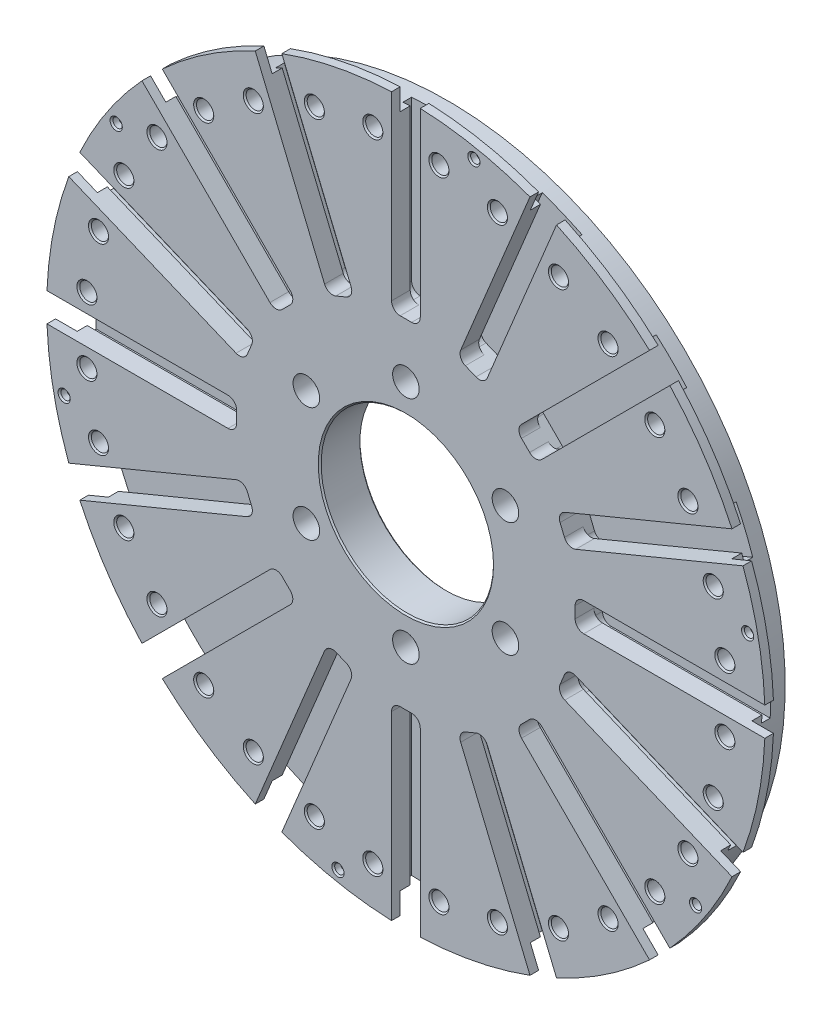
from build123d import *

# Parameters (mm, degrees)
SCHIZZO1_R                      = 250
ESTRUSIONE_ESTRUSIONE1_DEPTH    = 29
TAGLIO_ESTRUSIONE1_START        = -23
SCHIZZO2_R                      = 250
SCHIZZO2_R_2                    = 235
TAGLIO_ESTRUSIONE1_DEPTH        = 23
FORO1_D                         = 12.5
FORO1_DEPTH                     = 29.849623113
FORO1_CBORE_D                   = 18.5
FORO1_CBORE_DEPTH               = 13
RIPETIZIONECIRCOLARE1_COUNT     = 6
FORO_12_0_12_1_D                = 12
SCHIZZO9_R                      = 60
TAGLIO_ESTRUSIONE2_DEPTH        = 29
SCHIZZO10_R                     = 3.25
TAGLIO_ESTRUSIONE3_DEPTH        = 6
RIPETIZIONECIRCOLARE3_COUNT     = 3
RIPETIZIONECIRCOLARE3_ANGLE     = 135
SCHIZZO11_R                     = 3.25
TAGLIO_ESTRUSIONE4_DEPTH        = 6
RIPETIZIONECIRCOLARE4_COUNT     = 3
RIPETIZIONECIRCOLARE4_ANGLE     = 135
TAGLIO_ESTRUSIONE5_DEPTH        = 13
TAGLIO_ESTRUSIONE6_DEPTH        = 6
SMUSSO1_SIZE                    = 1
RIPETIZIONECIRCOLARE7_COUNT     = 16
RIPETIZIONECIRCOLARE7_COPY_1_D  = 12
RIPETIZIONECIRCOLARE7_COPY_2_D  = 12
RIPETIZIONECIRCOLARE7_COPY_3_D  = 12
RIPETIZIONECIRCOLARE7_COPY_4_D  = 12
RIPETIZIONECIRCOLARE7_COPY_5_D  = 12
RIPETIZIONECIRCOLARE7_COPY_6_D  = 12
RIPETIZIONECIRCOLARE7_COPY_7_D  = 12
RIPETIZIONECIRCOLARE7_COPY_8_D  = 12
RIPETIZIONECIRCOLARE7_COPY_9_D  = 12
RIPETIZIONECIRCOLARE7_COPY_10_D = 12
RIPETIZIONECIRCOLARE7_COPY_11_D = 12
RIPETIZIONECIRCOLARE7_COPY_12_D = 12
RIPETIZIONECIRCOLARE7_COPY_13_D = 12
RIPETIZIONECIRCOLARE7_COPY_14_D = 12
RIPETIZIONECIRCOLARE7_COPY_15_D = 12
SMUSSO3_SIZE                    = 1
SMUSSO4_SIZE                    = 1


with BuildPart() as part:
    # Schizzo1 → Estrusione-Estrusione1 (new body)
    with BuildSketch(Plane.XY):
        Circle(SCHIZZO1_R)
    extrude(amount=-ESTRUSIONE_ESTRUSIONE1_DEPTH)

    # Schizzo2 → Taglio-Estrusione1 (cut)
    with BuildSketch(Plane(origin=(0, 0, -29), x_dir=(-1, 0, 0), z_dir=(0, 0, -1)).offset(TAGLIO_ESTRUSIONE1_START)):
        with Locations(Location((0, 0, 0), (0, 0, 180))):
            Circle(SCHIZZO2_R)
        Circle(SCHIZZO2_R_2, mode=Mode.SUBTRACT)
    extrude(amount=TAGLIO_ESTRUSIONE1_DEPTH, mode=Mode.SUBTRACT)

    # Foro1
    with Locations(Plane.XY):
        with Locations((0, 80)):
            foro1 = CounterBoreHole(FORO1_D / 2, FORO1_CBORE_D / 2, FORO1_CBORE_DEPTH, depth=FORO1_DEPTH)

    # RipetizioneCircolare1: Foro1 ×6 about axis
    ripetizionecircolare1_axis = Axis((0, 0, 0), (0, 0, 1))
    for i in range(1, RIPETIZIONECIRCOLARE1_COUNT):
        add(foro1.rotate(ripetizionecircolare1_axis, i * 360 / RIPETIZIONECIRCOLARE1_COUNT), mode=Mode.SUBTRACT)

    # Foro Ø12.0 (12)-1 (through all)
    with Locations(Plane.XY):
        with Locations((-222, 23)):
            foro_12_0_12_1 = Hole(FORO_12_0_12_1_D / 2)

    # Schizzo9 → Taglio-Estrusione2 (cut)
    with BuildSketch(Plane.XY):
        Circle(SCHIZZO9_R)
    extrude(amount=-TAGLIO_ESTRUSIONE2_DEPTH, mode=Mode.SUBTRACT)

    # Specchia1: Foro Ø12.0 (12)-1 across plane
    add(foro_12_0_12_1.mirror(Plane.ZX), mode=Mode.SUBTRACT)

    # Schizzo10 → Taglio-Estrusione3 (cut)
    with BuildSketch(Plane.XY):
        with Locations((-201.631380983, 134.725781507)):
            Circle(SCHIZZO10_R)
    taglio_estrusione3 = extrude(amount=-TAGLIO_ESTRUSIONE3_DEPTH, mode=Mode.SUBTRACT)

    # RipetizioneCircolare3: Taglio-Estrusione3 ×3 about axis
    ripetizionecircolare3_axis = Axis((0, 0, 0), (0, 0, -1))
    for i in range(1, RIPETIZIONECIRCOLARE3_COUNT):
        add(taglio_estrusione3.rotate(ripetizionecircolare3_axis, i * RIPETIZIONECIRCOLARE3_ANGLE / (RIPETIZIONECIRCOLARE3_COUNT - 1)), mode=Mode.SUBTRACT)

    # Schizzo11 → Taglio-Estrusione4 (cut)
    with BuildSketch(Plane.XY):
        with Locations((-237.840430498, -47.309403089)):
            Circle(SCHIZZO11_R)
    taglio_estrusione4 = extrude(amount=-TAGLIO_ESTRUSIONE4_DEPTH, mode=Mode.SUBTRACT)

    # RipetizioneCircolare4: Taglio-Estrusione4 ×3 about axis
    ripetizionecircolare4_axis = Axis((0, 0, 0), (0, 0, 1))
    for i in range(1, RIPETIZIONECIRCOLARE4_COUNT):
        add(taglio_estrusione4.rotate(ripetizionecircolare4_axis, i * RIPETIZIONECIRCOLARE4_ANGLE / (RIPETIZIONECIRCOLARE4_COUNT - 1)), mode=Mode.SUBTRACT)

    # Schizzo13 → Taglio-Estrusione5 (cut)
    with BuildSketch(Plane.XY):
        with BuildLine():
            Line((-117.799919936, 4), (-117.799919936, -4))
            ThreePointArc((-117.799919936, -4), (-119.557279249, -8.242640687), (-123.799919936, -10))
            Line((-123.799919936, -10), (-249.799919936, -10))
            ThreePointArc((-249.799919936, -10), (-250, 0), (-249.799919936, 10))
            Line((-249.799919936, 10), (-123.799919936, 10))
            ThreePointArc((-123.799919936, 10), (-119.557279249, 8.242640687), (-117.799919936, 4))
        make_face()
    taglio_estrusione5 = extrude(amount=-TAGLIO_ESTRUSIONE5_DEPTH, mode=Mode.SUBTRACT)

    # Schizzo14 → Taglio-Estrusione6 (cut)
    with BuildSketch(Plane.XY.offset(-13)):
        with BuildLine():
            Line((-117.799919936, 9), (-117.799919936, -9))
            ThreePointArc((-117.799919936, -9), (-119.557279249, -13.242640687), (-123.799919936, -15))
            Line((-123.799919936, -15), (-235, -15))
            Line((-235, -15), (-235, 15))
            Line((-235, 15), (-123.799919936, 15))
            ThreePointArc((-123.799919936, 15), (-119.557279249, 13.242640687), (-117.799919936, 9))
        make_face()
    taglio_estrusione6 = extrude(amount=-TAGLIO_ESTRUSIONE6_DEPTH, mode=Mode.SUBTRACT)

    # Smusso1
    smusso1_edges = [part.edges().sort_by_distance(p)[0] for p in [
        (-60, 0, 0),
        (-60, 0, -29),
    ]]
    chamfer(smusso1_edges, length=SMUSSO1_SIZE)

    # RipetizioneCircolare7: Foro Ø12.0 (12)-1, Taglio-Estrusione5, Taglio-Estrusione6 ×16 about axis
    ripetizionecircolare7_axis = Axis((0, 0, 0), (0, 0, 1))
    add([foro_12_0_12_1.rotate(ripetizionecircolare7_axis, i * 360 / RIPETIZIONECIRCOLARE7_COUNT) for i in range(1, RIPETIZIONECIRCOLARE7_COUNT)], mode=Mode.SUBTRACT)
    add([taglio_estrusione5.rotate(ripetizionecircolare7_axis, i * 360 / RIPETIZIONECIRCOLARE7_COUNT) for i in range(1, RIPETIZIONECIRCOLARE7_COUNT)], mode=Mode.SUBTRACT)
    add([taglio_estrusione6.rotate(ripetizionecircolare7_axis, i * 360 / RIPETIZIONECIRCOLARE7_COUNT) for i in range(1, RIPETIZIONECIRCOLARE7_COUNT)], mode=Mode.SUBTRACT)

    # RipetizioneCircolare7 copy 1 (through all)
    with Locations(Plane(origin=(0, 0, 0), x_dir=(0.9238795325112867, 0.3826834323650898, 0), z_dir=(0, 0, 1))):
        with Locations((-222, -23)):
            Hole(RIPETIZIONECIRCOLARE7_COPY_1_D / 2)

    # RipetizioneCircolare7 copy 2 (through all)
    with Locations(Plane(origin=(0, 0, 0), x_dir=(0.7071067811865476, 0.7071067811865475, 0), z_dir=(0, 0, 1))):
        with Locations((-222, -23)):
            Hole(RIPETIZIONECIRCOLARE7_COPY_2_D / 2)

    # RipetizioneCircolare7 copy 3 (through all)
    with Locations(Plane(origin=(0, 0, 0), x_dir=(0.38268343236508984, 0.9238795325112867, 0), z_dir=(0, 0, 1))):
        with Locations((-222, -23)):
            Hole(RIPETIZIONECIRCOLARE7_COPY_3_D / 2)

    # RipetizioneCircolare7 copy 4 (through all)
    with Locations(Plane(origin=(0, 0, 0), x_dir=(0, 1, 0), z_dir=(0, 0, 1))):
        with Locations((-222, -23)):
            Hole(RIPETIZIONECIRCOLARE7_COPY_4_D / 2)

    # RipetizioneCircolare7 copy 5 (through all)
    with Locations(Plane(origin=(0, 0, 0), x_dir=(-0.3826834323650897, 0.9238795325112867, 0), z_dir=(0, 0, 1))):
        with Locations((-222, -23)):
            Hole(RIPETIZIONECIRCOLARE7_COPY_5_D / 2)

    # RipetizioneCircolare7 copy 6 (through all)
    with Locations(Plane(origin=(0, 0, 0), x_dir=(-0.7071067811865475, 0.7071067811865476, 0), z_dir=(0, 0, 1))):
        with Locations((-222, -23)):
            Hole(RIPETIZIONECIRCOLARE7_COPY_6_D / 2)

    # RipetizioneCircolare7 copy 7 (through all)
    with Locations(Plane(origin=(0, 0, 0), x_dir=(-0.9238795325112867, 0.3826834323650899, 0), z_dir=(0, 0, 1))):
        with Locations((-222, -23)):
            Hole(RIPETIZIONECIRCOLARE7_COPY_7_D / 2)

    # RipetizioneCircolare7 copy 8 (through all)
    with Locations(Plane(origin=(0, 0, 0), x_dir=(-1, 0, 0), z_dir=(0, 0, 1))):
        with Locations((-222, -23)):
            Hole(RIPETIZIONECIRCOLARE7_COPY_8_D / 2)

    # RipetizioneCircolare7 copy 9 (through all)
    with Locations(Plane(origin=(0, 0, 0), x_dir=(-0.9238795325112868, -0.38268343236508967, 0), z_dir=(0, 0, 1))):
        with Locations((-222, -23)):
            Hole(RIPETIZIONECIRCOLARE7_COPY_9_D / 2)

    # RipetizioneCircolare7 copy 10 (through all)
    with Locations(Plane(origin=(0, 0, 0), x_dir=(-0.7071067811865477, -0.7071067811865475, 0), z_dir=(0, 0, 1))):
        with Locations((-222, -23)):
            Hole(RIPETIZIONECIRCOLARE7_COPY_10_D / 2)

    # RipetizioneCircolare7 copy 11 (through all)
    with Locations(Plane(origin=(0, 0, 0), x_dir=(-0.3826834323650895, -0.9238795325112868, 0), z_dir=(0, 0, 1))):
        with Locations((-222, -23)):
            Hole(RIPETIZIONECIRCOLARE7_COPY_11_D / 2)

    # RipetizioneCircolare7 copy 12 (through all)
    with Locations(Plane(origin=(0, 0, 0), x_dir=(0, -1, 0), z_dir=(0, 0, 1))):
        with Locations((-222, -23)):
            Hole(RIPETIZIONECIRCOLARE7_COPY_12_D / 2)

    # RipetizioneCircolare7 copy 13 (through all)
    with Locations(Plane(origin=(0, 0, 0), x_dir=(0.38268343236509, -0.9238795325112866, 0), z_dir=(0, 0, 1))):
        with Locations((-222, -23)):
            Hole(RIPETIZIONECIRCOLARE7_COPY_13_D / 2)

    # RipetizioneCircolare7 copy 14 (through all)
    with Locations(Plane(origin=(0, 0, 0), x_dir=(0.7071067811865474, -0.7071067811865477, 0), z_dir=(0, 0, 1))):
        with Locations((-222, -23)):
            Hole(RIPETIZIONECIRCOLARE7_COPY_14_D / 2)

    # RipetizioneCircolare7 copy 15 (through all)
    with Locations(Plane(origin=(0, 0, 0), x_dir=(0.9238795325112868, -0.38268343236508956, 0), z_dir=(0, 0, 1))):
        with Locations((-222, -23)):
            Hole(RIPETIZIONECIRCOLARE7_COPY_15_D / 2)

    # Smusso3
    smusso3_edges = [part.edges().sort_by_distance(p)[0] for p in [
        (-190.756260078, 103.908850639, 0),
        (-190.756260078, 103.908850639, -29),
        (-136.471608769, 168.998520704, 0),
        (-136.471608769, 168.998520704, -29),
        (-61.410392143, 208.359697967, 0),
        (-61.410392143, 208.359697967, -29),
        (23, 216, 0),
        (23, 216, -29),
        (103.908850639, 190.756260078, 0),
        (103.908850639, 190.756260078, -29),
        (168.998520704, 136.471608769, 0),
        (168.998520704, 136.471608769, -29),
        (208.359697967, 61.410392143, 0),
        (208.359697967, 61.410392143, -29),
        (216, -23, 0),
        (216, -23, -29),
        (190.756260078, -103.908850639, 0),
        (190.756260078, -103.908850639, -29),
        (136.471608769, -168.998520704, 0),
        (136.471608769, -168.998520704, -29),
        (61.410392143, -208.359697967, 0),
        (61.410392143, -208.359697967, -29),
        (-23, -216, 0),
        (-23, -216, -29),
        (-103.908850639, -190.756260078, 0),
        (-103.908850639, -190.756260078, -29),
        (-168.998520704, -136.471608769, 0),
        (-168.998520704, -136.471608769, -29),
        (-208.359697967, -61.410392143, 0),
        (-208.359697967, -61.410392143, -29),
        (-208.359697967, 61.410392143, 0),
        (-208.359697967, 61.410392143, -29),
        (-168.998520704, 136.471608769, 0),
        (-168.998520704, 136.471608769, -29),
        (-103.908850639, 190.756260078, 0),
        (-103.908850639, 190.756260078, -29),
        (-23, 216, 0),
        (-23, 216, -29),
        (61.410392143, 208.359697967, 0),
        (61.410392143, 208.359697967, -29),
        (136.471608769, 168.998520704, 0),
        (136.471608769, 168.998520704, -29),
        (190.756260078, 103.908850639, 0),
        (190.756260078, 103.908850639, -29),
        (216, 23, 0),
        (216, 23, -29),
        (208.359697967, -61.410392143, 0),
        (208.359697967, -61.410392143, -29),
        (168.998520704, -136.471608769, 0),
        (168.998520704, -136.471608769, -29),
        (103.908850639, -190.756260078, 0),
        (103.908850639, -190.756260078, -29),
        (23, -216, 0),
        (23, -216, -29),
        (-61.410392143, -208.359697967, 0),
        (-61.410392143, -208.359697967, -29),
        (-136.471608769, -168.998520704, 0),
        (-136.471608769, -168.998520704, -29),
        (-190.756260078, -103.908850639, 0),
        (-190.756260078, -103.908850639, -29),
        (-216, 23, 0),
        (-216, 23, -29),
        (-216, -23, 0),
        (-216, -23, -29),
        (-204.881380983, 134.725781507, 0),
        (-204.881380983, 134.725781507, -6),
        (46.065681934, 240.843038978, 0),
        (46.065681934, 240.843038978, -6),
        (240.138527537, 49.607500128, 0),
        (240.138527537, 49.607500128, -6),
        (-241.090430498, -47.309403089, 0),
        (-241.090430498, -47.309403089, -6),
        (-48.553124244, -240.843038978, 0),
        (-48.553124244, -240.843038978, -6),
        (203.929478022, -137.023878546, 0),
    ]]
    chamfer(smusso3_edges, length=SMUSSO3_SIZE)

    # Smusso4
    smusso4_edges = [part.edges().sort_by_distance(p)[0] for p in [
        (6.25, 80, -29),
        (-66.157032303, 45.412658774, -29),
        (-72.407032303, -34.587341226, -29),
        (-6.25, -80, -29),
        (66.157032303, -45.412658774, -29),
        (72.407032303, 34.587341226, -29),
    ]]
    chamfer(smusso4_edges, length=SMUSSO4_SIZE)


solid = part.part
